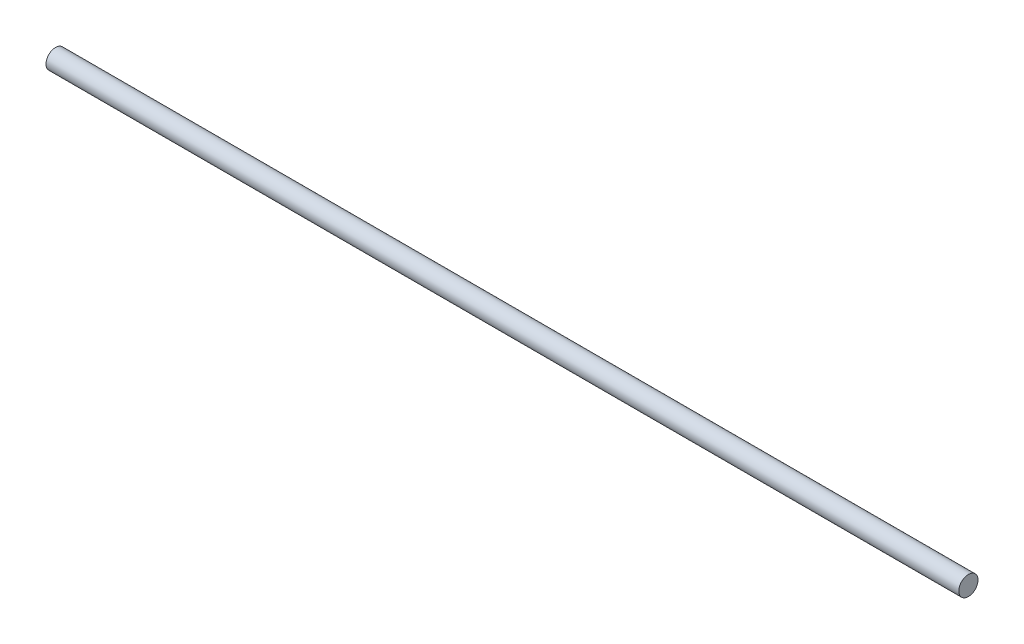
from build123d import *

# Parameters (mm, degrees)
SKETCH1_R           = 2
BOSS_EXTRUDE1_DEPTH = 95


with BuildPart() as part:
    # Sketch1 → Boss-Extrude1 (new, symmetric)
    with BuildSketch(Plane(origin=(0, 0, 0), x_dir=(0, 0, -1), z_dir=(1, 0, 0))):
        Circle(SKETCH1_R)
    extrude(amount=BOSS_EXTRUDE1_DEPTH, both=True)


solid = part.part
